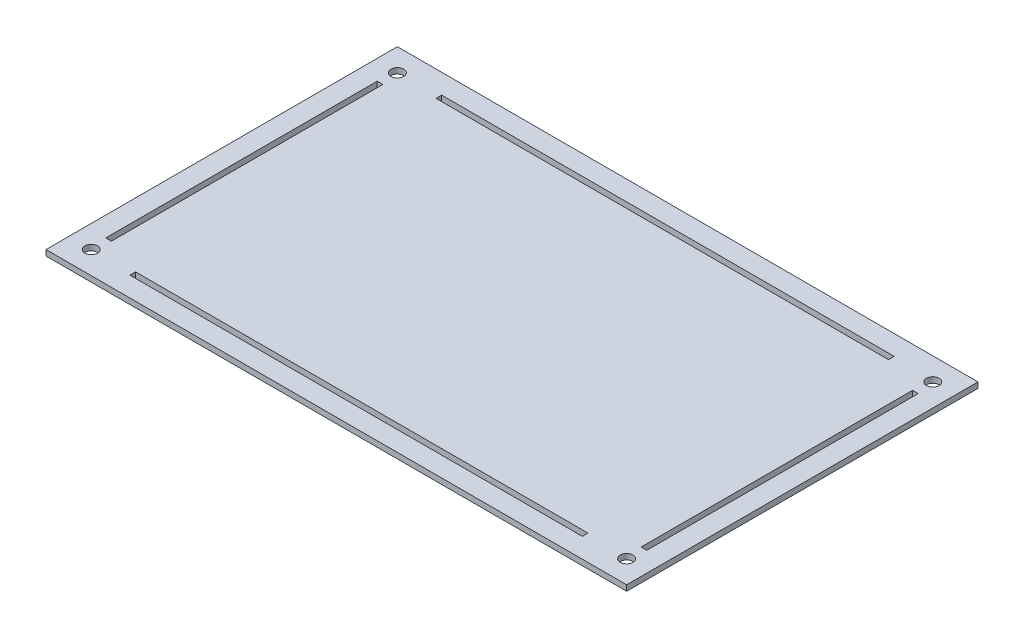
from build123d import *

# Parameters (mm, degrees)
SKETCH1_W               = 325.9836
SKETCH1_H               = 197.27926
BOSS_EXTRUDE1_DEPTH     = 3.175
F_1_4_CLEARANCE_HOLE1_D = 7.14248
SKETCH4_W               = 3.175
SKETCH4_H               = 152.4
SKETCH4_W_2             = 254
SKETCH4_H_2             = 3.175
CUT_EXTRUDE1_DEPTH      = 191.541817192


with BuildPart() as part:
    # Sketch1 → Boss-Extrude1 (new body)
    with BuildSketch(Plane(origin=(0, 0, 0), x_dir=(1, 0, 0), z_dir=(0, 1, 0))):
        Rectangle(SKETCH1_W, SKETCH1_H)
    extrude(amount=BOSS_EXTRUDE1_DEPTH)

    # 1/4 Clearance Hole1 (through all)
    with Locations(Plane(origin=(0, 3.175, 0), x_dir=(1, 0, 0), z_dir=(0, 1, 0))):
        with Locations((-150.2918, 85.93963), (150.2918, 85.93963), (150.2918, -85.93963), (-150.2918, -85.93963)):
            Hole(F_1_4_CLEARANCE_HOLE1_D / 2)

    # Sketch4 → Cut-Extrude1 (cut, through all)
    with BuildSketch(Plane(origin=(0, 3.175, 0), x_dir=(1, 0, 0), z_dir=(0, 1, 0))):
        with Locations((-150.2918, 0)):
            Rectangle(SKETCH4_W, SKETCH4_H)
        with Locations((150.2918, 0)):
            Rectangle(SKETCH4_W, SKETCH4_H)
        with Locations((0, 85.93963)):
            Rectangle(SKETCH4_W_2, SKETCH4_H_2)
        with Locations((0, -85.93963)):
            Rectangle(SKETCH4_W_2, SKETCH4_H_2)
    extrude(amount=-CUT_EXTRUDE1_DEPTH, mode=Mode.SUBTRACT)


solid = part.part
